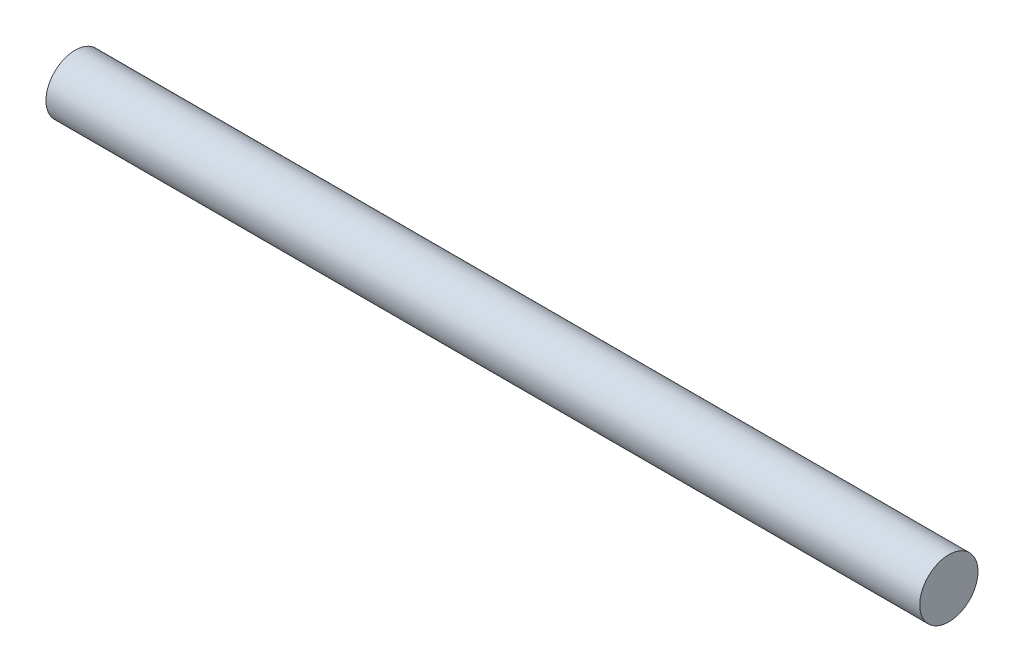
from build123d import *

# Parameters (mm, degrees)
SKETCH2_R           = 5
BOSS_EXTRUDE1_DEPTH = 150


with BuildPart() as part:
    # Sketch2 → Boss-Extrude1 (new body)
    with BuildSketch(Plane(origin=(0, 0, 0), x_dir=(0, 0, -1), z_dir=(1, 0, 0))):
        Circle(SKETCH2_R)
    extrude(amount=BOSS_EXTRUDE1_DEPTH)


solid = part.part
